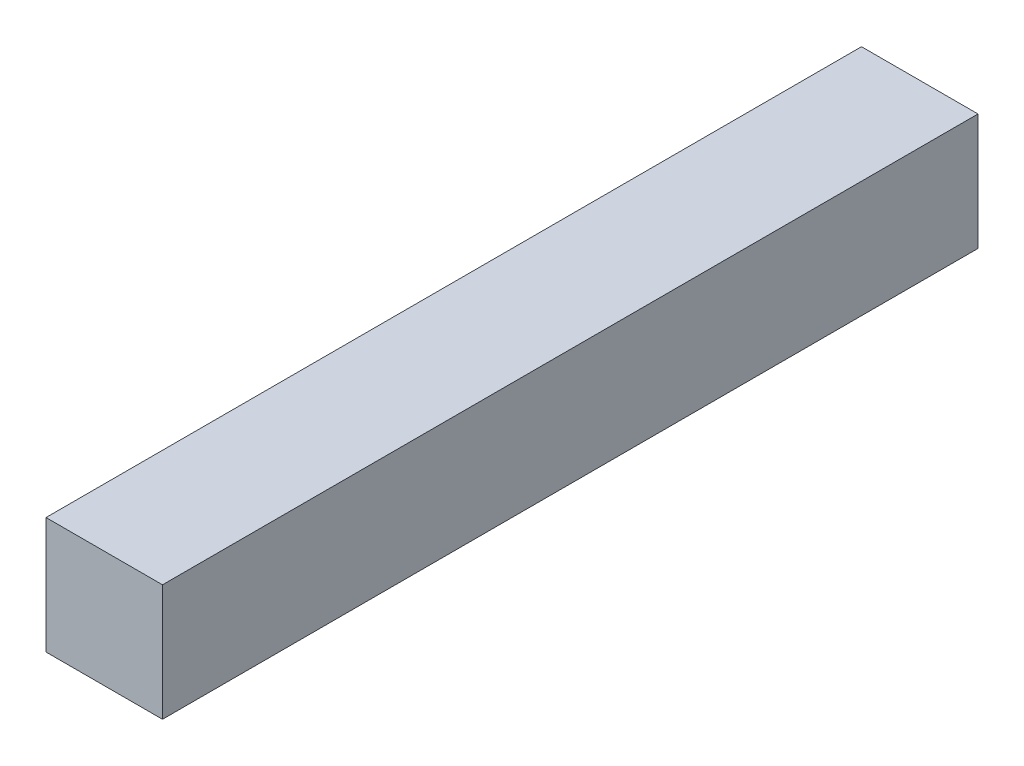
from build123d import *

# Parameters (mm, degrees)
ESQUISSE1_W        = 10
ESQUISSE1_H        = 10
BOSS_EXTRU_1_DEPTH = 70


with BuildPart() as part:
    # Esquisse1 → Boss.-Extru.1 (new body)
    with BuildSketch(Plane.XY):
        with Locations((5, 5)):
            Rectangle(ESQUISSE1_W, ESQUISSE1_H)
    extrude(amount=BOSS_EXTRU_1_DEPTH)


solid = part.part
